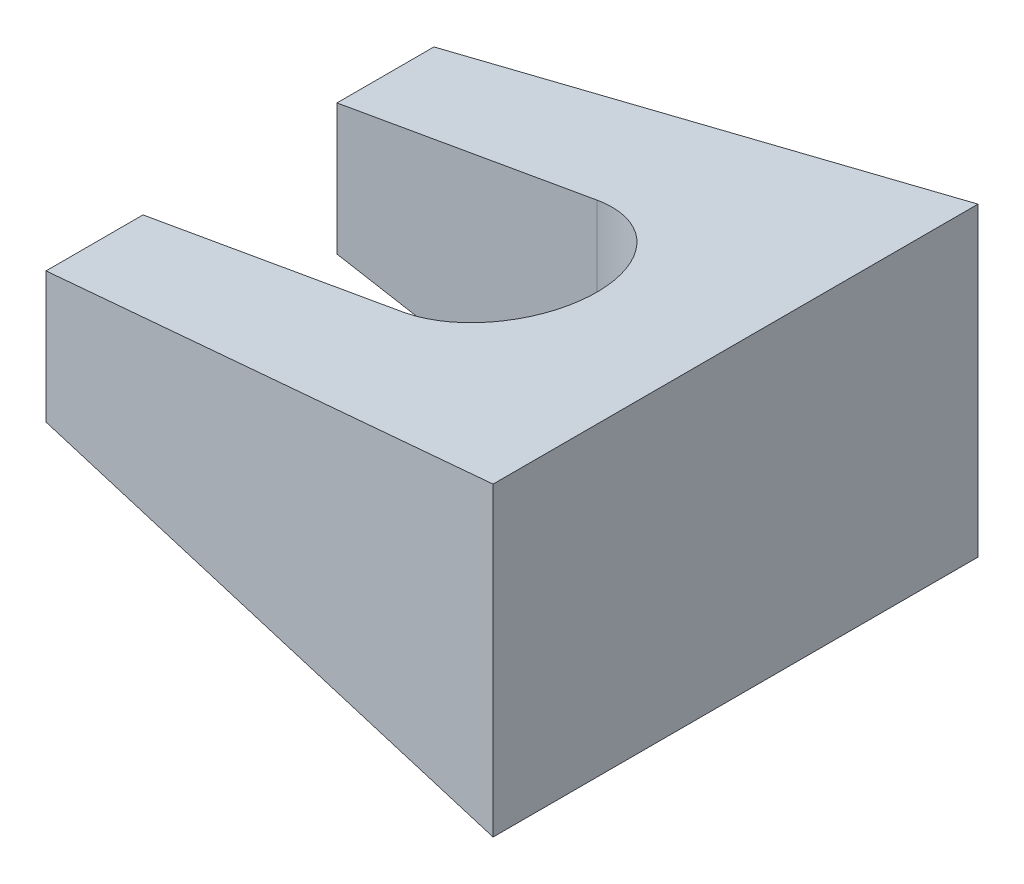
from build123d import *

# Parameters (mm, degrees)
BOSS_EXTRUDE1_DEPTH     = 25
CUT_EXTRUDE1_DEPTH      = 31.731494025
CUT_EXTRUDE1_DEPTH_BACK = 31.731494025
SKETCH2_OUTSIDE_W       = 39.84
SKETCH2_OUTSIDE_H       = 64.292
CUT_EXTRUDE2_DEPTH      = 20.532560663
CUT_EXTRUDE2_DEPTH_BACK = 20.532560663


with BuildPart() as part:
    # Sketch1 → Boss-Extrude1 (new, symmetric)
    with BuildSketch(Plane(origin=(0, 0, 0), x_dir=(1, 0, 0), z_dir=(0, 1, 0))):
        Polygon((-12.773986261, -10), (-12.773986261, 10), (12.773986261, 12.5), (12.773986261, -12.5), align=None)
    extrude(amount=BOSS_EXTRUDE1_DEPTH, both=True)

    # Sketch2 outside → Cut-Extrude1 (cut, two sides: drawn at the far end of the back side and taken through both)
    with BuildSketch(Plane.XY.offset(-CUT_EXTRUDE1_DEPTH_BACK)):
        Rectangle(SKETCH2_OUTSIDE_W, SKETCH2_OUTSIDE_H)
        Polygon((-12.773986261, -3.375317421), (-12.773986261, 3.375317421), (12.773986261, 7.880114279), (12.773986261, -7.880114279), align=None, mode=Mode.SUBTRACT)
    extrude(amount=CUT_EXTRUDE1_DEPTH + CUT_EXTRUDE1_DEPTH_BACK, mode=Mode.SUBTRACT)

    # Sketch3 → Cut-Extrude2 (cut, two sides: drawn at the far end of the back side and taken through both)
    with BuildSketch(Plane(origin=(0, 0, 0), x_dir=(1, 0, 0), z_dir=(0, 1, 0)).offset(-CUT_EXTRUDE2_DEPTH_BACK)):
        with BuildLine():
            Line((-17.816892232, 5), (0.620317331, 5))
            ThreePointArc((0.620317331, 5), (5.620317331, 0), (0.620317331, -5))
            Line((0.620317331, -5), (-17.816892232, -5))
            Line((-17.816892232, -5), (-17.816892232, 5))
        make_face()
    extrude(amount=CUT_EXTRUDE2_DEPTH + CUT_EXTRUDE2_DEPTH_BACK, mode=Mode.SUBTRACT)


solid = part.part
